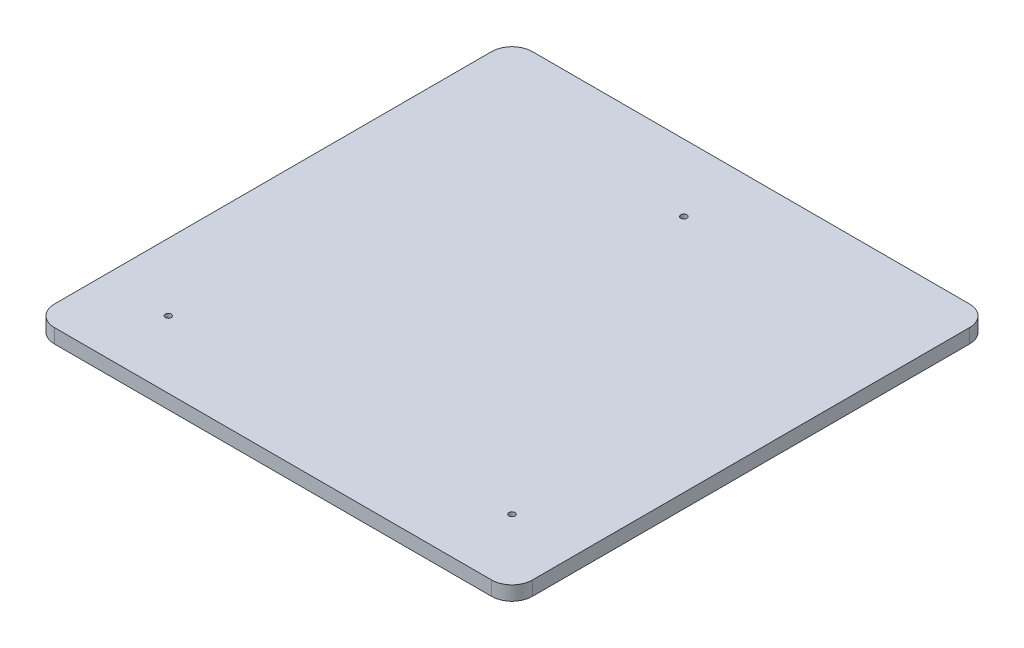
from build123d import *

# Parameters (mm, degrees)
SKETCH1_W           = 235
SKETCH1_H           = 235
SKETCH1_R           = 1.5
BOSS_EXTRUDE1_DEPTH = 7
FILLET1_R           = 10


with BuildPart() as part:
    # Sketch1 → Boss-Extrude1 (new body)
    with BuildSketch(Plane(origin=(0, 0, 0), x_dir=(1, 0, 0), z_dir=(0, 1, 0))):
        Rectangle(SKETCH1_W, SKETCH1_H)
        with Locations(Location((0, 84.5, 0), (0, 0, 270))):
            Circle(SKETCH1_R, mode=Mode.SUBTRACT)
        with Locations(Location((84.5, -84.5, 0), (0, 0, 270))):
            Circle(SKETCH1_R, mode=Mode.SUBTRACT)
        with Locations(Location((-84.5, -84.5, 0), (0, 0, 270))):
            Circle(SKETCH1_R, mode=Mode.SUBTRACT)
    extrude(amount=BOSS_EXTRUDE1_DEPTH)

    # Fillet1
    fillet1_edges = [part.edges().sort_by_distance(p)[0] for p in [
        (117.5, 3.5, 117.5),
        (-117.5, 3.5, 117.5),
        (-117.5, 3.5, -117.5),
        (117.5, 3.5, -117.5),
    ]]
    fillet(fillet1_edges, radius=FILLET1_R)


solid = part.part
